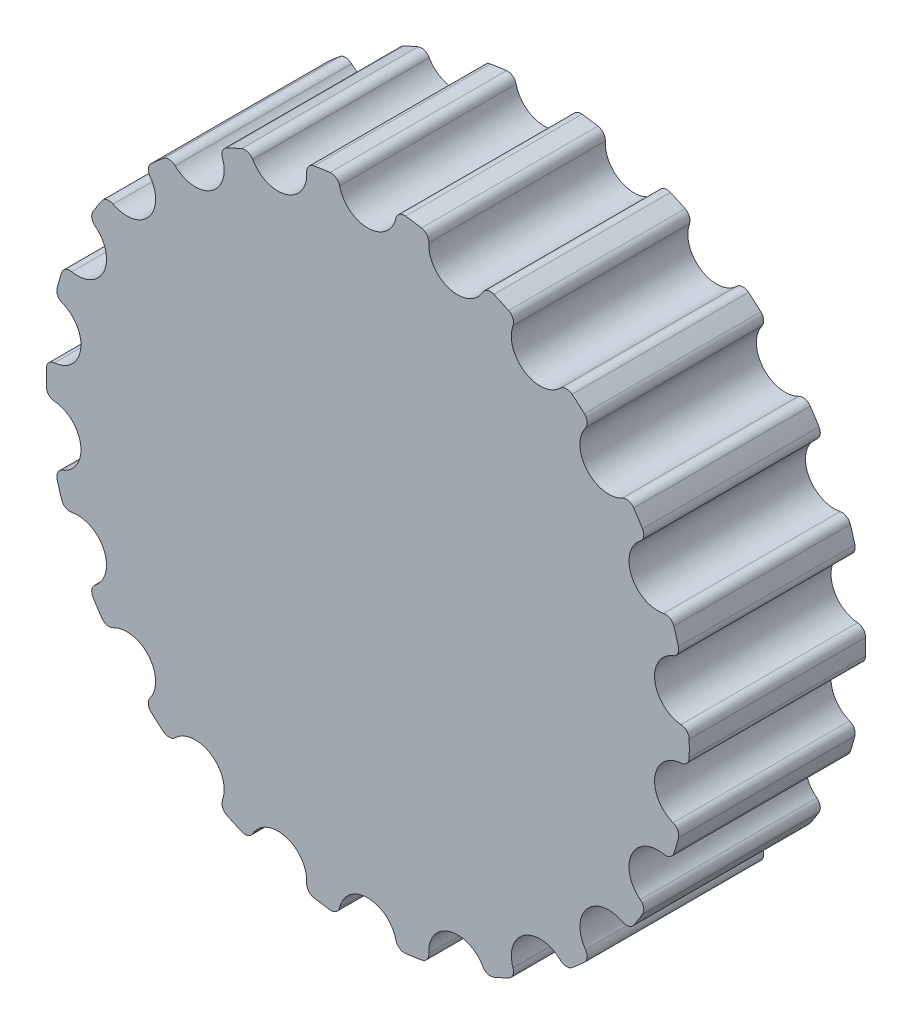
from build123d import *

# Parameters (mm, degrees)
SKETCH1_R           = 27.325470016
BOSS_EXTRUDE1_DEPTH = 7.5
CUT_EXTRUDE1_DEPTH  = 7.5
CIRPATTERN1_COUNT   = 22


with BuildPart() as part:
    # Sketch1 → Boss-Extrude1 (new, symmetric)
    with BuildSketch(Plane.XY):
        Circle(SKETCH1_R)
    extrude(amount=BOSS_EXTRUDE1_DEPTH, both=True)

    # Sketch1<3> → Cut-Extrude1 (cut, symmetric)
    with BuildSketch(Plane.XY):
        with BuildLine():
            ThreePointArc((2.389000136, 26.557966834), (2.687762275, 27.004338738), (3.208387057, 27.136461893))
            ThreePointArc((3.208387057, 27.136461893), (-2.8e-08, 27.325470016), (-3.208387112, 27.136461887))
            ThreePointArc((-3.208387112, 27.136461887), (-2.687762323, 27.004338772), (-2.38900015, 26.557966895))
            ThreePointArc((-2.38900015, 26.557966895), (-3.2e-08, 24.651270016), (2.389000136, 26.557966834))
        make_face()
    cut_extrude1 = extrude(amount=CUT_EXTRUDE1_DEPTH, both=True, mode=Mode.SUBTRACT)

    # CirPattern1: Cut-Extrude1 ×22 about axis
    cirpattern1_axis = Axis((0, 0, 7.5), (0, 0, 1))
    for i in range(1, CIRPATTERN1_COUNT):
        add(cut_extrude1.rotate(cirpattern1_axis, i * 360 / CIRPATTERN1_COUNT), mode=Mode.SUBTRACT)


solid = part.part
